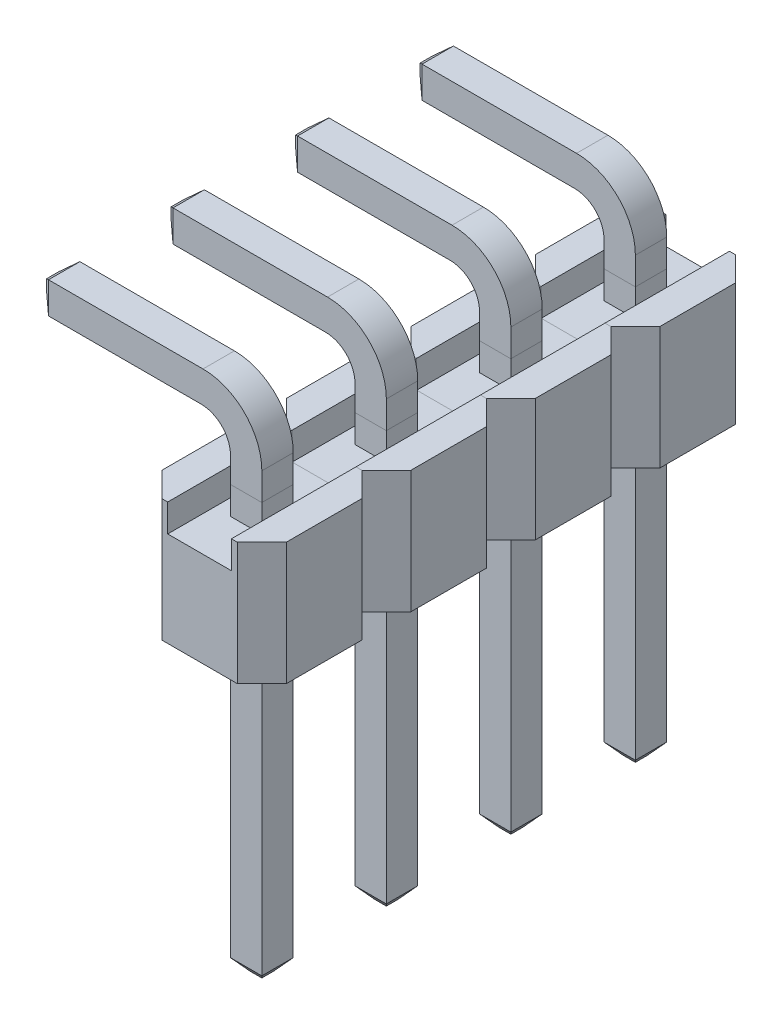
from build123d import *

# Parameters (mm, degrees)
SKETCH_1_W        = 2.54
SKETCH_1_H        = 2.54
BODY_DEPTH        = 2.5
SKETCH_3_W        = 1.3
SKETCH_3_H        = 0.564870384
GROOVE_DEPTH      = 3
CHAMFER_2_SIZE    = 0.5
SKETCH_2_W        = 0.64
SKETCH_2_H        = 0.64
PIN_DEPTH         = 8.6
PINCHAMFER_SIZE   = 0.2
PINCHAMFER_SIZE2  = 0.238350719
RPIN_DEPTH        = 0.64
RPINCHAMFER_SIZE  = 0.2
RPINCHAMFER_SIZE2 = 0.238350719
LPATTERN2_COUNT   = 4
LPATTERN2_PITCH   = 2.54


with BuildPart() as part:
    # Эскиз1 → Body (new body)
    with BuildSketch(Plane(origin=(0, 0, 0), x_dir=(1, 0, 0), z_dir=(0, 1, 0))):
        Rectangle(SKETCH_1_W, SKETCH_1_H)
    extrude(amount=BODY_DEPTH)

    # Эскиз3 → Groove (cut)
    with BuildSketch(Plane.XY.offset(1.27)):
        with Locations((0, 2.217564808)):
            Rectangle(SKETCH_3_W, SKETCH_3_H)
    extrude(amount=-GROOVE_DEPTH, mode=Mode.SUBTRACT)

    # Chamfer 2
    chamfer_2_edges = [part.edges().sort_by_distance(p)[0] for p in [
        (-1.27, 1.25, -1.27),
        (1.27, 1.25, -1.27),
        (1.27, 1.25, 1.27),
        (-1.27, 1.25, 1.27),
    ]]
    chamfer(chamfer_2_edges, length=CHAMFER_2_SIZE)

    # Эскиз2 → Pin (add)
    with BuildSketch(Plane(origin=(0, 2.5, 0), x_dir=(1, 0, 0), z_dir=(0, 1, 0))):
        Rectangle(SKETCH_2_W, SKETCH_2_H)
    extrude(amount=-PIN_DEPTH)

    # PinChamfer
    pinchamfer_edges = [part.edges().sort_by_distance(p)[0] for p in [
        (-0.32, -6.1, 0),
        (0, -6.1, -0.32),
        (0.32, -6.1, 0),
        (0, -6.1, 0.32),
    ]]
    pinchamfer_side = [part.faces().sort_by_distance(p)[0] for p in [
        (0, -6.1, 0),
    ]]
    chamfer(pinchamfer_edges, length=PINCHAMFER_SIZE, length2=PINCHAMFER_SIZE2, reference=pinchamfer_side[0])


with BuildPart() as body_2:
    # Scetch → RPin (new body)
    with BuildSketch(Plane(origin=(0, 0, -0.32), x_dir=(-1, 0, 0), z_dir=(0, 0, -1))):
        with BuildLine():
            Line((0.88, 4.26), (4.27, 4.26))
            Line((4.27, 4.26), (4.27, 3.62))
            Line((4.27, 3.62), (0.92, 3.62))
            ThreePointArc((0.92, 3.62), (0.495735931, 3.444264069), (0.32, 3.02))
            Line((0.32, 3.02), (0.32, 2.5))
            Line((0.32, 2.5), (-0.32, 2.5))
            Line((-0.32, 2.5), (-0.32, 3.06))
            ThreePointArc((-0.32, 3.06), (0.031471863, 3.908528137), (0.88, 4.26))
        make_face()
    extrude(amount=-RPIN_DEPTH)

    # RPinChamfer
    rpinchamfer_edges = [body_2.edges().sort_by_distance(p)[0] for p in [
        (-4.27, 3.62, 0),
        (-4.27, 3.94, 0.32),
        (-4.27, 4.26, 0),
        (-4.27, 3.94, -0.32),
    ]]
    rpinchamfer_side = [body_2.faces().sort_by_distance(p)[0] for p in [
        (-4.27, 3.94, 0),
    ]]
    chamfer(rpinchamfer_edges, length=RPINCHAMFER_SIZE, length2=RPINCHAMFER_SIZE2, reference=rpinchamfer_side[0])


with BuildPart() as lpattern2_1:
    # LPattern2: pattern copy
    add(body_2.part.moved(Location(Vector(0, 0, 1) * (1 * LPATTERN2_PITCH))))


with BuildPart() as lpattern2_2:
    # LPattern2: pattern copy
    add(body_2.part.moved(Location(Vector(0, 0, 1) * (2 * LPATTERN2_PITCH))))


with BuildPart() as lpattern2_3:
    # LPattern2: pattern copy
    add(body_2.part.moved(Location(Vector(0, 0, 1) * (3 * LPATTERN2_PITCH))))


with BuildPart() as lpattern2_4:
    # LPattern2: pattern copy
    add(part.part.moved(Location(Vector(0, 0, 1) * (1 * LPATTERN2_PITCH))))


with BuildPart() as lpattern2_5:
    # LPattern2: pattern copy
    add(part.part.moved(Location(Vector(0, 0, 1) * (2 * LPATTERN2_PITCH))))


with BuildPart() as lpattern2_6:
    # LPattern2: pattern copy
    add(part.part.moved(Location(Vector(0, 0, 1) * (3 * LPATTERN2_PITCH))))


solid = Compound([part.part, body_2.part, lpattern2_1.part, lpattern2_2.part, lpattern2_3.part, lpattern2_4.part, lpattern2_5.part, lpattern2_6.part])
